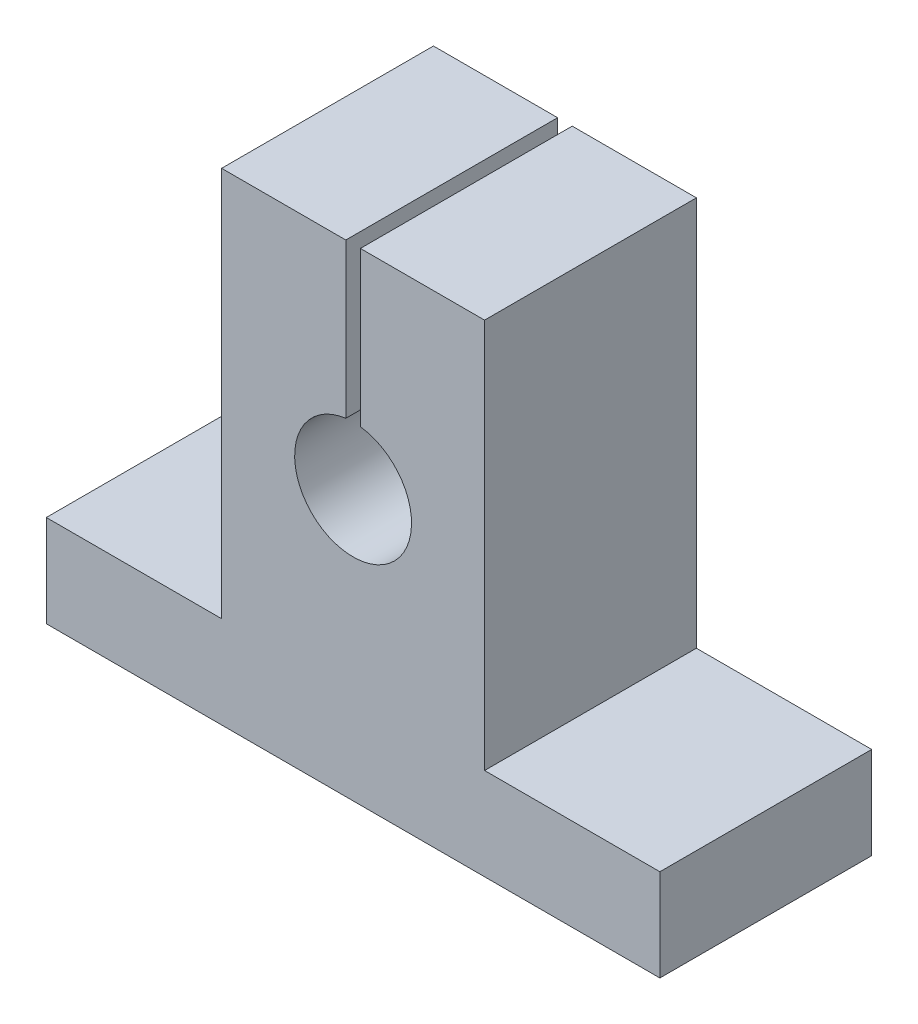
from build123d import *

# Parameters (mm, degrees)
BOSS_EXTRUDE1_DEPTH = 14.5


with BuildPart() as part:
    # Sketch1 → Boss-Extrude1 (new body)
    with BuildSketch(Plane.XY):
        with BuildLine():
            Line((-21, 0), (21, 0))
            Line((21, 0), (21, 6.3))
            Line((21, 6.3), (9, 6.3))
            Line((9, 6.3), (9, 33))
            Line((9, 33), (0.5, 33))
            Line((0.5, 33), (0.5, 22.429667223))
            ThreePointArc((0.5, 22.429667223), (0, 14.461040256), (-0.5, 22.429667223))
            Line((-0.5, 22.429667223), (-0.5, 33))
            Line((-0.5, 33), (-9, 33))
            Line((-9, 33), (-9, 6.3))
            Line((-9, 6.3), (-21, 6.3))
            Line((-21, 6.3), (-21, 0))
        make_face()
    extrude(amount=BOSS_EXTRUDE1_DEPTH)


solid = part.part
